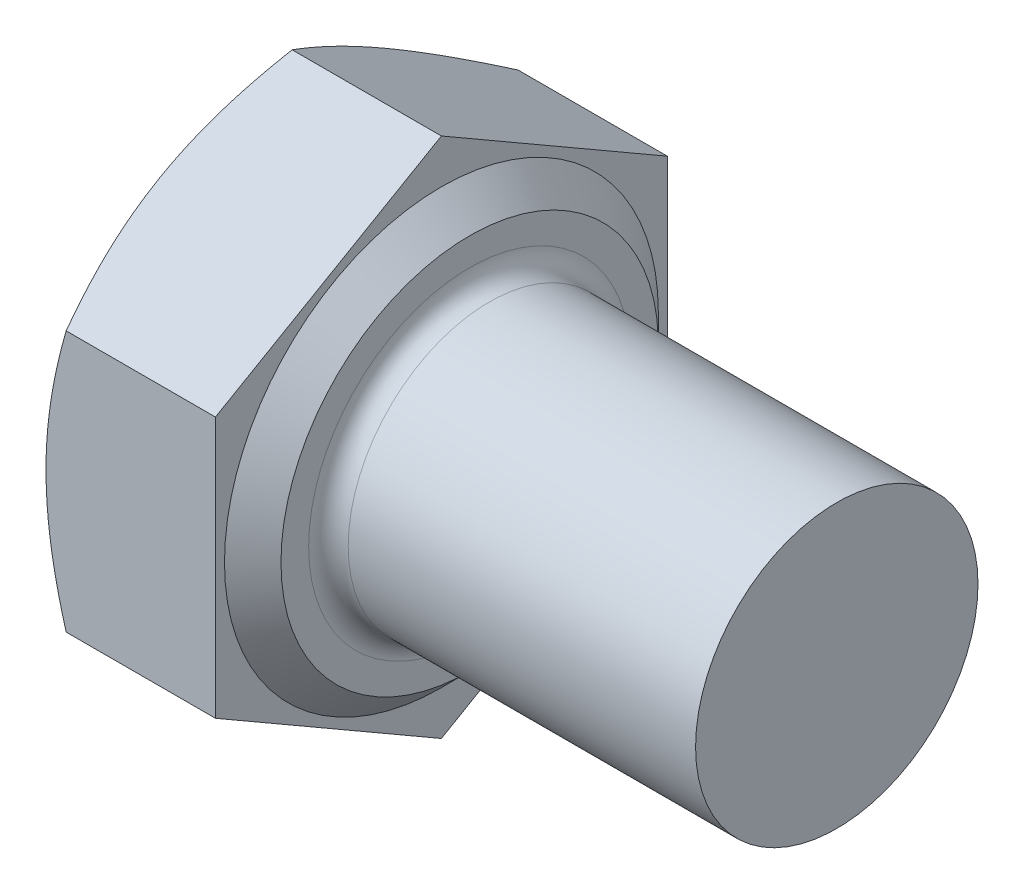
from build123d import *

# Parameters (mm, degrees)
EXTRUDE_1_DEPTH     = 3.5
SKETCH_4_R          = 8.79
SKETCH_4_R_2        = 4
CUT_EXTRUDE_1_DEPTH = 0.4375
CUT_EXTRUDE_1_DRAFT = -60
CHAMFER_2_SIZE      = 0.277777778
SKETCH_9_W          = 7
SKETCH_9_H          = 5
CUT_EXTRUDE_2_DEPTH = 5


with BuildPart() as part:
    # 草图3 → 凸台-拉伸1 (new body)
    with BuildSketch(Plane(origin=(0, 0, 0), x_dir=(0, 0, -1), z_dir=(1, 0, 0))):
        Polygon((4, 2.309401077), (0, 4.618802154), (-4, 2.309401077), (-4, -2.309401077), (0, -4.618802154), (4, -2.309401077), align=None)
    extrude(amount=EXTRUDE_1_DEPTH)


with BuildPart() as cut_extrude_1_tool:
    # 草图4 → 切除-拉伸1 (with draft: the straight prism first)
    with BuildSketch(Plane.ZY):
        Circle(SKETCH_4_R)
        Circle(SKETCH_4_R_2, mode=Mode.SUBTRACT)
    extrude(amount=-CUT_EXTRUDE_1_DEPTH)
    # 切除-拉伸1: the draft: its side faces are tilted about the plane it starts from
    cut_extrude_1_sides = [cut_extrude_1_tool.faces().sort_by_distance(p)[0] for p in [
        (0.21875, 0, -8.79),
        (0.21875, 0, -4),
    ]]
    draft(cut_extrude_1_sides, Plane.ZY, CUT_EXTRUDE_1_DRAFT)


with BuildPart() as part_1:
    add(part.part)

    # 切除-拉伸1: cut by cut_extrude_1_tool
    add(cut_extrude_1_tool.part, mode=Mode.SUBTRACT)

    # 草图5 → 旋转1 (revolve)
    with BuildSketch(Plane.XY, mode=Mode.PRIVATE) as revolve_1_sk:
        with BuildLine():
            Line((3.85, 2.5), (13.5, 2.5))
            Line((13.5, 2.5), (13.5, 0))
            Line((13.5, 0), (3.5, 0))
            Line((3.5, 0), (3.5, 2.85))
            ThreePointArc((3.5, 2.85), (3.602512627, 2.602512627), (3.85, 2.5))
        make_face()
    revolve(revolve_1_sk.sketch.rotate(Axis((3.5, 0, 0), (1, 0, 0)), 90), axis=Axis((3.5, 0, 0), (1, 0, 0)))

    # 倒角2
    chamfer_2_edges = [part_1.edges().sort_by_distance(p)[0] for p in [
        (13.5, 0, -2.5),
    ]]
    chamfer(chamfer_2_edges, length=CHAMFER_2_SIZE)

    # 草图7 → 切除-旋转1 (revolve, cut)
    with BuildSketch(Plane.XY, mode=Mode.PRIVATE) as cut_revolve_1_sk:
        Polygon((3.5, 3.34), (3, 3.84), (3, 8.79), (3.5, 8.79), align=None)
    revolve(cut_revolve_1_sk.sketch.rotate(Axis((0, 0, 0), (1, 0, 0)), 90), axis=Axis((0, 0, 0), (1, 0, 0)), mode=Mode.SUBTRACT)

    # 草图9 → 切除-拉伸2 (cut, symmetric)
    with BuildSketch(Plane.XY):
        with Locations((13.5, 0)):
            Rectangle(SKETCH_9_W, SKETCH_9_H)
    extrude(amount=CUT_EXTRUDE_2_DEPTH, both=True, mode=Mode.SUBTRACT)


solid = part_1.part
